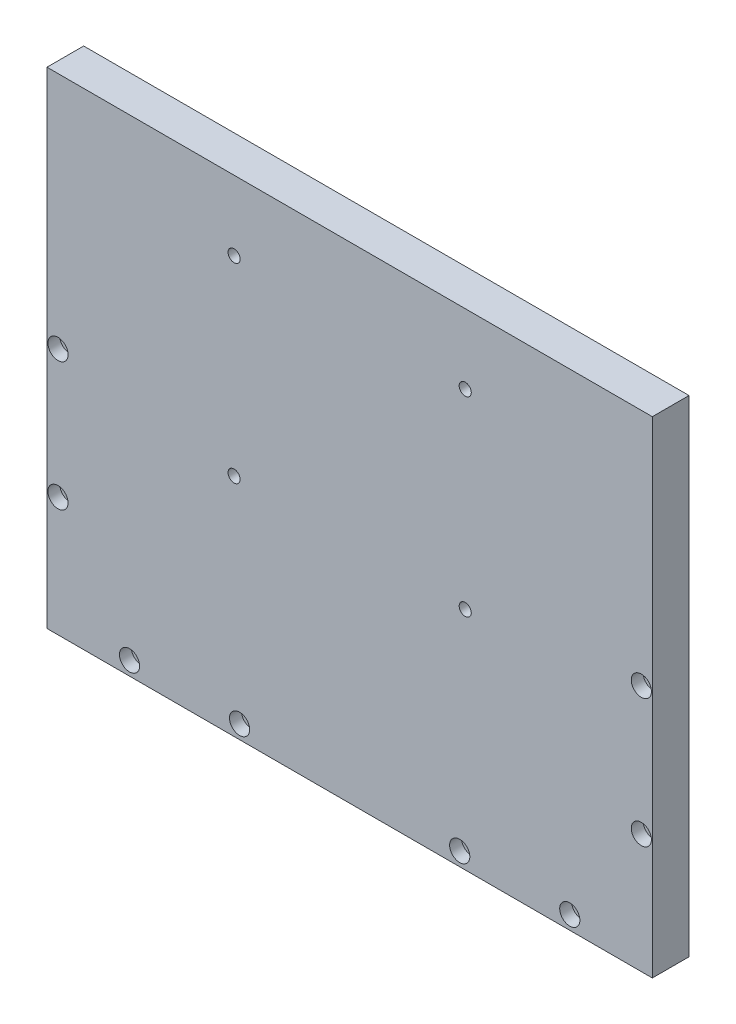
from build123d import *

# Parameters (mm, degrees)
SKETCH1_W               = 330
SKETCH1_H               = 265
BOSS_EXTRUDE1_DEPTH     = 20
CUT_EXTRUDE1_DEPTH      = 242.350367723
CUT_EXTRUDE1_DEPTH_BACK = 242.350367723
SKETCH2_R               = 3.3
SKETCH3_R               = 5.5
CUT_EXTRUDE3_DEPTH      = 6.5
CUT_EXTRUDE4_DEPTH      = 242.350367723
CUT_EXTRUDE4_DEPTH_BACK = 242.350367723
SKETCH4_R               = 3.3
SKETCH5_R               = 5.5
CUT_EXTRUDE6_DEPTH      = 6.5
CUT_EXTRUDE7_DEPTH      = 242.350367723
CUT_EXTRUDE7_DEPTH_BACK = 242.350367723
SKETCH6_R               = 3.3
SKETCH7_R               = 5.5
CUT_EXTRUDE9_DEPTH      = 6.5


with BuildPart() as part:
    # Sketch1 → Boss-Extrude1 (new body)
    with BuildSketch(Plane.XY):
        with Locations((0, -42.5)):
            Rectangle(SKETCH1_W, SKETCH1_H)
    extrude(amount=BOSS_EXTRUDE1_DEPTH)

    # Sketch2 → Cut-Extrude1 (cut, two sides: drawn at the far end of the back side and taken through both)
    with BuildSketch(Plane.XY.offset(-CUT_EXTRUDE1_DEPTH_BACK)):
        with Locations((-63, -52)):
            Circle(SKETCH2_R)
        with Locations((-63, 52)):
            Circle(SKETCH2_R)
        with Locations((63, -52)):
            Circle(SKETCH2_R)
        with Locations((63, 52)):
            Circle(SKETCH2_R)
    extrude(amount=CUT_EXTRUDE1_DEPTH + CUT_EXTRUDE1_DEPTH_BACK, mode=Mode.SUBTRACT)

    # Sketch3 → Cut-Extrude3 (cut)
    with BuildSketch(Plane.XY):
        with Locations((-63, -52)):
            Circle(SKETCH3_R)
        with Locations((-63, 52)):
            Circle(SKETCH3_R)
        with Locations((63, -52)):
            Circle(SKETCH3_R)
        with Locations((63, 52)):
            Circle(SKETCH3_R)
    extrude(amount=CUT_EXTRUDE3_DEPTH, mode=Mode.SUBTRACT)

    # Sketch4 → Cut-Extrude4 (cut, two sides: drawn at the far end of the back side and taken through both)
    with BuildSketch(Plane.XY.offset(-CUT_EXTRUDE4_DEPTH_BACK)):
        with Locations((-120, -167.5)):
            Circle(SKETCH4_R)
        with Locations((-60, -167.5)):
            Circle(SKETCH4_R)
        with Locations((60, -167.5)):
            Circle(SKETCH4_R)
        with Locations((120, -167.5)):
            Circle(SKETCH4_R)
    extrude(amount=CUT_EXTRUDE4_DEPTH + CUT_EXTRUDE4_DEPTH_BACK, mode=Mode.SUBTRACT)

    # Sketch5 → Cut-Extrude6 (cut)
    with BuildSketch(Plane.XY.offset(20)):
        with Locations((-120, -167.5)):
            Circle(SKETCH5_R)
        with Locations((-60, -167.5)):
            Circle(SKETCH5_R)
        with Locations((60, -167.5)):
            Circle(SKETCH5_R)
        with Locations((120, -167.5)):
            Circle(SKETCH5_R)
    extrude(amount=-CUT_EXTRUDE6_DEPTH, mode=Mode.SUBTRACT)

    # Sketch6 → Cut-Extrude7 (cut, two sides: drawn at the far end of the back side and taken through both)
    with BuildSketch(Plane.XY.offset(-CUT_EXTRUDE7_DEPTH_BACK)):
        with Locations((-159, -110)):
            Circle(SKETCH6_R)
        with Locations((-159, -40)):
            Circle(SKETCH6_R)
        with Locations((159, -110)):
            Circle(SKETCH6_R)
        with Locations((159, -40)):
            Circle(SKETCH6_R)
    extrude(amount=CUT_EXTRUDE7_DEPTH + CUT_EXTRUDE7_DEPTH_BACK, mode=Mode.SUBTRACT)

    # Sketch7 → Cut-Extrude9 (cut)
    with BuildSketch(Plane.XY.offset(20)):
        with Locations((-159, -110)):
            Circle(SKETCH7_R)
        with Locations((-159, -40)):
            Circle(SKETCH7_R)
        with Locations((159, -110)):
            Circle(SKETCH7_R)
        with Locations((159, -40)):
            Circle(SKETCH7_R)
    extrude(amount=-CUT_EXTRUDE9_DEPTH, mode=Mode.SUBTRACT)


solid = part.part
